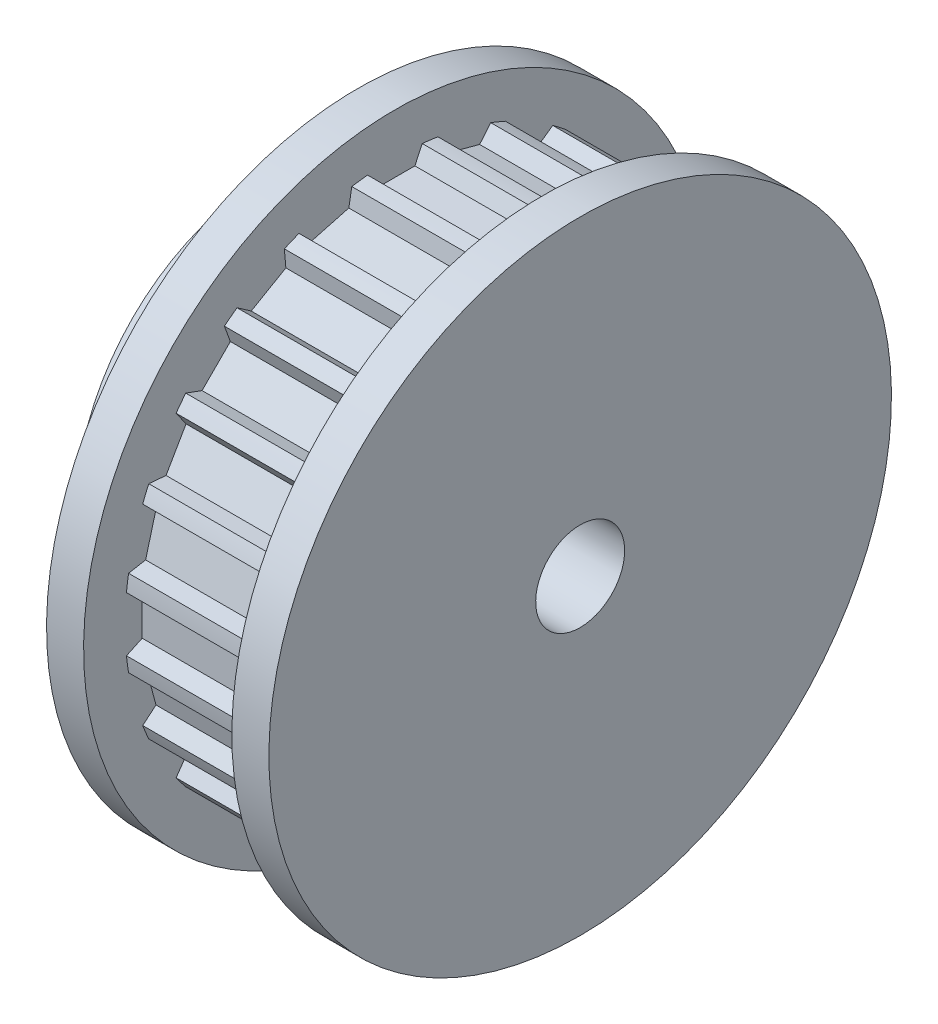
from build123d import *

# Parameters (mm, degrees)
CUT_EXTRUDE1_DEPTH = 10
CIRPATTERN1_COUNT  = 24


with BuildPart() as part:
    # Sketch1 → Revolve1 (revolve)
    with BuildSketch(Plane.XY, mode=Mode.PRIVATE) as revolve1_sk:
        Polygon((-10.5, 3), (10.5, 3), (10.5, 21), (8, 21), (8, 18.45), (8, 18.2), (-2, 18.2), (-2, 18.45), (-2, 21), (-4.5, 21), (-4.5, 13), (-10.5, 13), align=None)
    revolve(revolve1_sk.sketch.rotate(Axis((-10.5, 0, 0), (1, 0, 0)), 180), axis=Axis((-10.5, 0, 0), (1, 0, 0)))

    # Sketch3 → Cut-Extrude1 (cut)
    with BuildSketch(Plane(origin=(-2, 0, 0), x_dir=(0, 0, -1), z_dir=(1, 0, 0))):
        with BuildLine():
            Line((-1.844146703, 18.106328257), (-1.35, 17.046627232))
            Line((-1.35, 17.046627232), (1.35, 17.046627232))
            Line((1.35, 17.046627232), (1.844146703, 18.106328257))
            ThreePointArc((1.844146703, 18.106328257), (0, 18.2), (-1.844146703, 18.106328257))
        make_face()
    cut_extrude1 = extrude(amount=CUT_EXTRUDE1_DEPTH, mode=Mode.SUBTRACT)

    # CirPattern1: Cut-Extrude1 ×24 about axis
    cirpattern1_axis = Axis((0, 0, 0), (1, 0, 0))
    for i in range(1, CIRPATTERN1_COUNT):
        add(cut_extrude1.rotate(cirpattern1_axis, i * 360 / CIRPATTERN1_COUNT), mode=Mode.SUBTRACT)


solid = part.part
